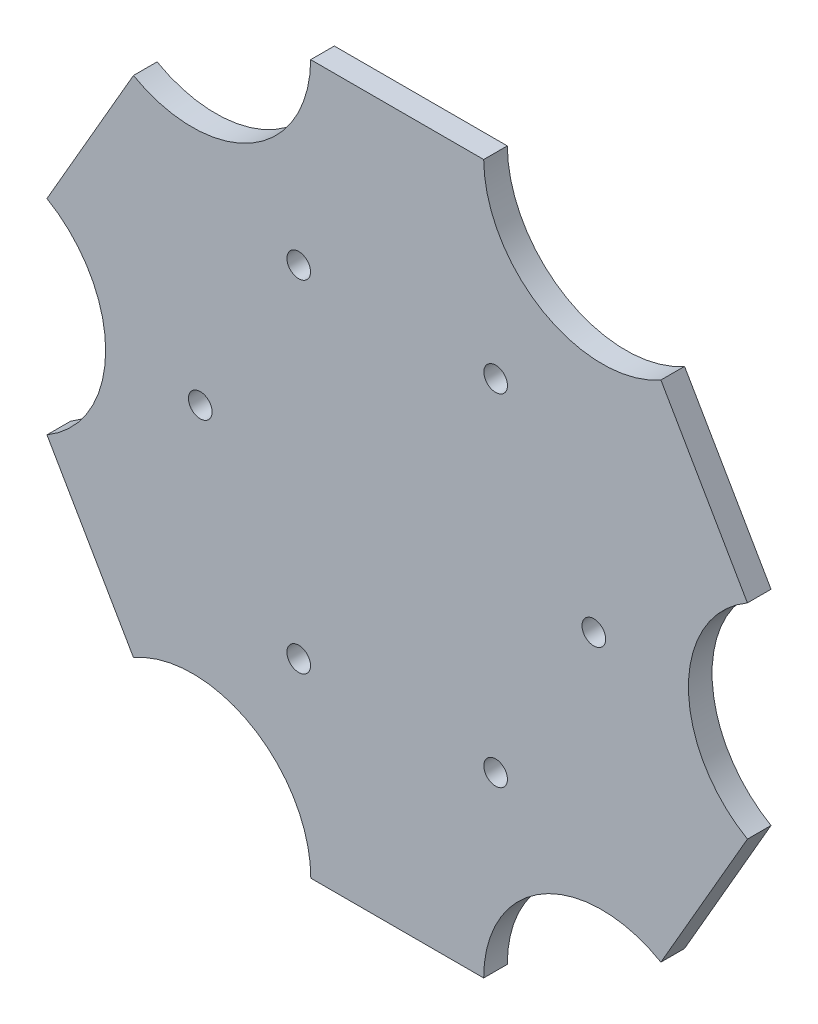
from build123d import *

# Parameters (mm, degrees)
SKETCH1_R           = 1.5
BOSS_EXTRUDE2_DEPTH = 3


with BuildPart() as part:
    # Sketch1 → Boss-Extrude2 (new body)
    with BuildSketch(Plane.XY):
        with BuildLine():
            Line((112.537432292, -12.976148301), (101.55666974, -31.995386946))
            ThreePointArc((101.55666974, -31.995386946), (109.008032648, -44.985766658), (101.55666973, -57.976146364))
            Line((101.55666973, -57.976146364), (112.543627726, -76.979851074))
            ThreePointArc((112.543627726, -76.979851074), (127.551006282, -76.975139288), (135.051396662, -89.973815277))
            Line((135.051396662, -89.973815277), (156.998958278, -89.973815277))
            ThreePointArc((156.998958278, -89.973815277), (164.494573478, -76.975838492), (179.498959173, -76.983429983))
            Line((179.498959173, -76.983429983), (190.479721714, -57.964195058))
            ThreePointArc((190.479721714, -57.964195058), (182.991636989, -44.979791002), (190.479721714, -31.995386946))
            Line((190.479721714, -31.995386946), (179.498959162, -12.976148301))
            ThreePointArc((179.498959162, -12.976148301), (164.527718005, -12.926335496), (156.998958268, 0.014233268))
            Line((156.998958268, 0.014233268), (135.037433186, 0.014233268))
            ThreePointArc((135.037433186, 0.014233268), (127.508673453, -12.926335503), (112.537432292, -12.976148301))
        make_face()
        with Locations((133.517432282, -23.333812148)):
            Circle(SKETCH1_R, mode=Mode.SUBTRACT)
        with Locations((158.518959173, -23.333812148)):
            Circle(SKETCH1_R, mode=Mode.SUBTRACT)
        with Locations((170.981637028, -44.98076105)):
            Circle(SKETCH1_R, mode=Mode.SUBTRACT)
        with Locations((121.018032609, -44.98479661)):
            Circle(SKETCH1_R, mode=Mode.SUBTRACT)
        with Locations((158.518959173, -66.625766658)):
            Circle(SKETCH1_R, mode=Mode.SUBTRACT)
        with Locations((133.517432282, -66.625766658)):
            Circle(SKETCH1_R, mode=Mode.SUBTRACT)
    extrude(amount=BOSS_EXTRUDE2_DEPTH)


solid = part.part
